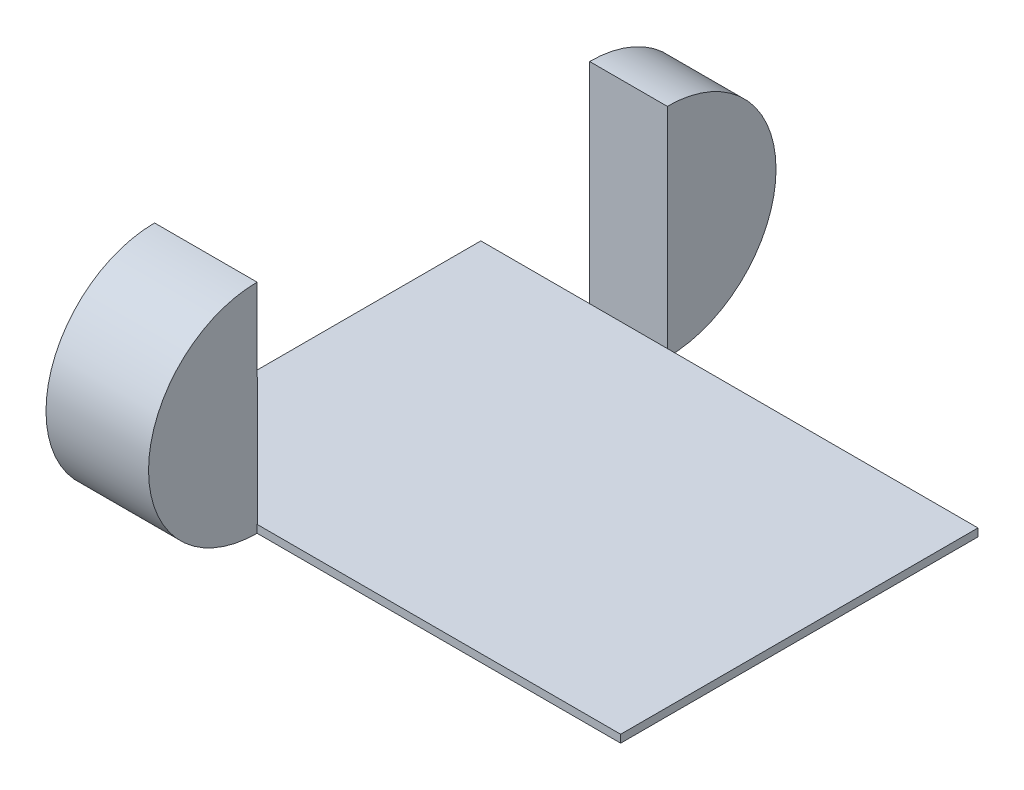
from build123d import *

# Parameters (mm, degrees)
SKETCH_1_W      = 32
SKETCH_1_H      = 23
EXTRUDE_1_DEPTH = 0.5
EXTRUDE_3_DEPTH = 5
EXTRUDE_4_DEPTH = 6.6


with BuildPart() as part:
    # 草图1 → 凸台-拉伸1 (new body)
    with BuildSketch(Plane(origin=(0, 0, 0), x_dir=(1, 0, 0), z_dir=(0, 1, 0))):
        Rectangle(SKETCH_1_W, SKETCH_1_H)
    extrude(amount=EXTRUDE_1_DEPTH)

    # 草图5 → 凸台-拉伸3 (add)
    with BuildSketch(Plane.ZY.offset(9)):
        with BuildLine():
            Line((-11.5, 0), (-11.5, 14))
            ThreePointArc((-11.5, 14), (-18.5, 7), (-11.5, 0))
        make_face()
    extrude(amount=-EXTRUDE_3_DEPTH)

    # 草图7 → 凸台-拉伸4 (add)
    with BuildSketch(Plane.ZY.offset(14)):
        with BuildLine():
            Line((11.473319553, 0), (11.5, 13.999974577))
            ThreePointArc((11.5, 13.999974577), (18.486647065, 6.986647065), (11.473319553, 0))
        make_face()
    extrude(amount=-EXTRUDE_4_DEPTH)


solid = part.part
